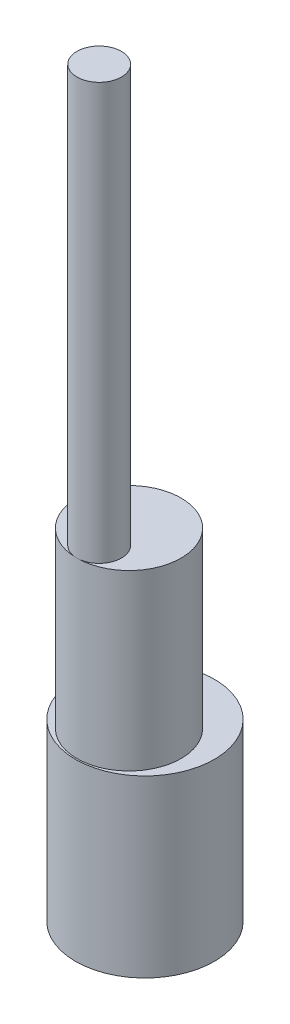
from build123d import *

# Parameters (mm, degrees)
BOSS_EXTRUDE1_DEPTH      = 1250
BOSS_EXTRUDE1_DEPTH_BACK = 10
SKETCH2_R                = 500
SKETCH3_R                = 375
BOSS_EXTRUDE2_DEPTH      = 1250
SKETCH5_R                = 160.219506603
BOSS_EXTRUDE3_DEPTH      = 3000


with BuildPart() as part:
    # Sketch2 → Boss-Extrude1 (new, two sides: drawn at the far end of the back side and taken through both)
    with BuildSketch(Plane(origin=(0, 0, 0), x_dir=(1, 0, 0), z_dir=(0, 1, 0)).offset(-BOSS_EXTRUDE1_DEPTH_BACK)):
        with Locations(Location((0, -1249.834667533, 0), (0, 0, 270))):
            Circle(SKETCH2_R)
    extrude(amount=BOSS_EXTRUDE1_DEPTH + BOSS_EXTRUDE1_DEPTH_BACK)

    # Sketch3 → Boss-Extrude2 (add)
    with BuildSketch(Plane(origin=(0, 1250, 0), x_dir=(1, 0, 0), z_dir=(0, 1, 0))):
        with Locations(Location((0, -1364.635099652, 0), (0, 0, 270))):
            Circle(SKETCH3_R)
    extrude(amount=BOSS_EXTRUDE2_DEPTH)

    # Sketch5 → Boss-Extrude3 (add)
    with BuildSketch(Plane(origin=(0, 2500, 0), x_dir=(1, 0, 0), z_dir=(0, 1, 0))):
        with Locations(Location((0, -1579.415593049, 0), (0, 0, 270))):
            Circle(SKETCH5_R)
    extrude(amount=BOSS_EXTRUDE3_DEPTH)


solid = part.part
